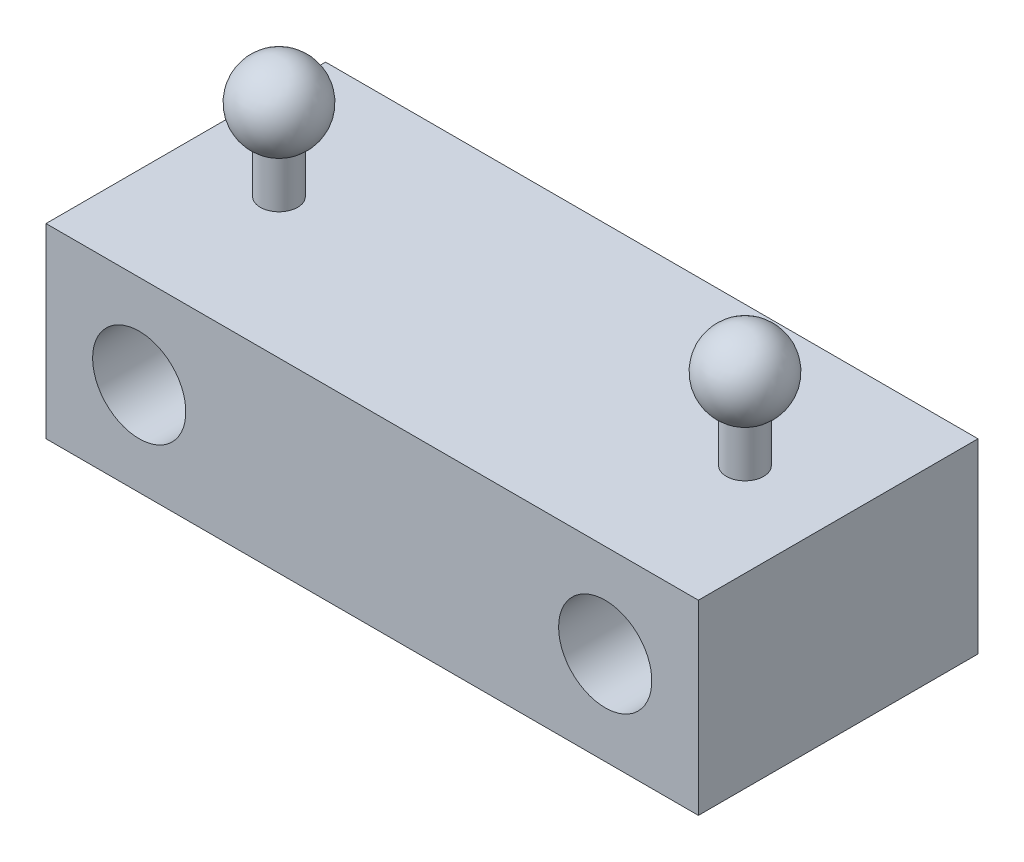
from build123d import *

# Parameters (mm, degrees)
SKETCH1_W           = 70
SKETCH1_H           = 30
BOSS_EXTRUDE1_DEPTH = 20
CUT_EXTRUDE1_REACH  = 52.249
SKETCH2_R           = 5
SKETCH3_R           = 2
BOSS_EXTRUDE2_DEPTH = 5
DOME1_FACE_RADIUS   = 2
DOME1_HEIGHT        = 8
DOME2_FACE_RADIUS   = 2
DOME2_HEIGHT        = 8


with BuildPart() as part:
    # Sketch1 → Boss-Extrude1 (new body)
    with BuildSketch(Plane(origin=(0, 0, 0), x_dir=(1, 0, 0), z_dir=(0, 1, 0))):
        Rectangle(SKETCH1_W, SKETCH1_H)
    extrude(amount=BOSS_EXTRUDE1_DEPTH)

    # Sketch2 → Cut-Extrude1 (cut, up to next)
    with BuildSketch(Plane(origin=(0, 0, -15), x_dir=(-1, 0, 0), z_dir=(0, 0, -1)), mode=Mode.PRIVATE) as cut_extrude1_sk1:
        with Locations((-25, 10)):
            Circle(SKETCH2_R)
    cut_extrude1_tool1 = extrude(cut_extrude1_sk1.sketch, amount=-CUT_EXTRUDE1_REACH, mode=Mode.PRIVATE) & part.part
    # Sketch2 → Cut-Extrude1 (cut, up to next)
    with BuildSketch(Plane(origin=(0, 0, -15), x_dir=(-1, 0, 0), z_dir=(0, 0, -1)), mode=Mode.PRIVATE) as cut_extrude1_sk2:
        with Locations((25, 10)):
            Circle(SKETCH2_R)
    cut_extrude1_tool2 = extrude(cut_extrude1_sk2.sketch, amount=-CUT_EXTRUDE1_REACH, mode=Mode.PRIVATE) & part.part
    add(cut_extrude1_tool1.solids().sort_by_distance((25, 10, -15))[0], mode=Mode.SUBTRACT)
    add(cut_extrude1_tool2.solids().sort_by_distance((-25, 10, -15))[0], mode=Mode.SUBTRACT)

    # Sketch3 → Boss-Extrude2 (add)
    with BuildSketch(Plane(origin=(0, 20, 0), x_dir=(1, 0, 0), z_dir=(0, 1, 0))):
        with Locations(Location((-25, 0, 0), (0, 0, 270))):
            Circle(SKETCH3_R)
        with Locations(Location((25, 0, 0), (0, 0, 270))):
            Circle(SKETCH3_R)
    extrude(amount=BOSS_EXTRUDE2_DEPTH)

    # Dome1: a dome of height H over a round flat face of radius A is a cap of a sphere of radius (A * A + H * H) / (2 * H)
    dome1_r = (DOME1_FACE_RADIUS * DOME1_FACE_RADIUS + DOME1_HEIGHT * DOME1_HEIGHT) / (2 * DOME1_HEIGHT)
    dome1_base = Plane((-25, 25, 0), z_dir=(0, 1, 0))
    with Locations(dome1_base.offset(DOME1_HEIGHT - dome1_r)):
        dome1_ball = Sphere(dome1_r, mode=Mode.PRIVATE)
    add(split(dome1_ball, bisect_by=dome1_base, keep=Keep.TOP, mode=Mode.PRIVATE))

    # Dome2: a dome of height H over a round flat face of radius A is a cap of a sphere of radius (A * A + H * H) / (2 * H)
    dome2_r = (DOME2_FACE_RADIUS * DOME2_FACE_RADIUS + DOME2_HEIGHT * DOME2_HEIGHT) / (2 * DOME2_HEIGHT)
    dome2_base = Plane((25, 25, 0), z_dir=(0, 1, 0))
    with Locations(dome2_base.offset(DOME2_HEIGHT - dome2_r)):
        dome2_ball = Sphere(dome2_r, mode=Mode.PRIVATE)
    add(split(dome2_ball, bisect_by=dome2_base, keep=Keep.TOP, mode=Mode.PRIVATE))


solid = part.part
